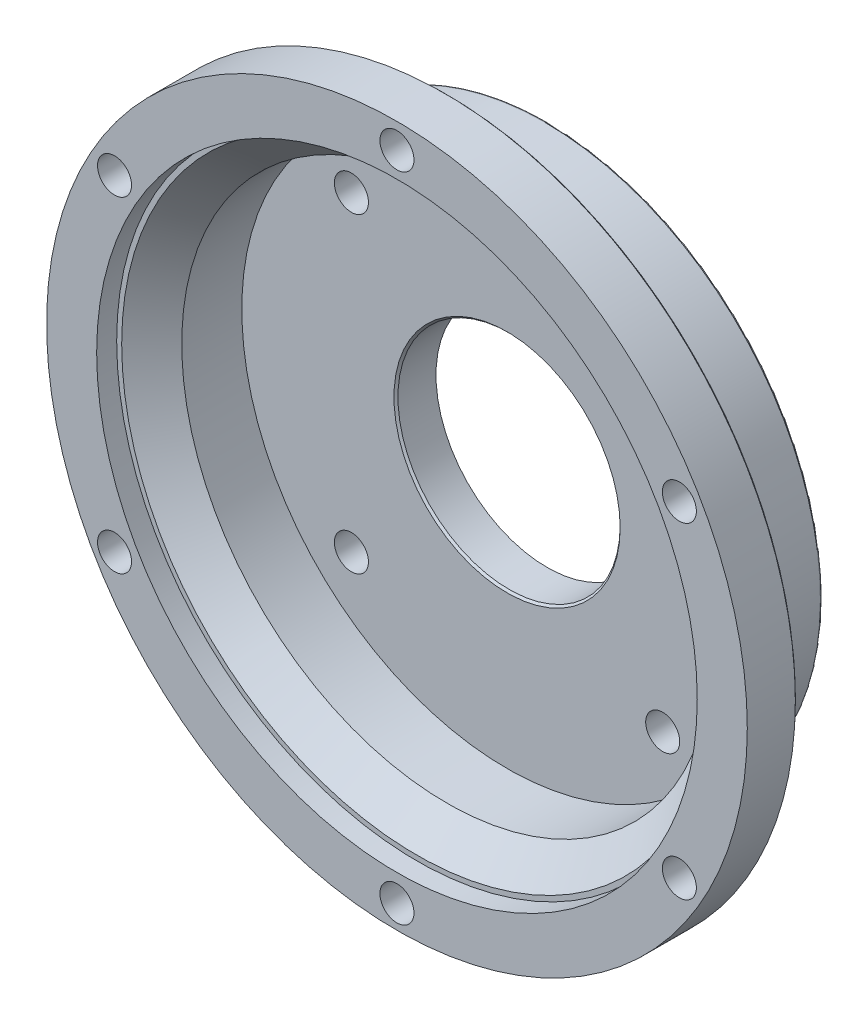
from build123d import *

# Parameters (mm, degrees)
BOSS_EXTRUDE1_DEPTH      = 5
BOSS_EXTRUDE1_DEPTH_BACK = 10
SKETCH1_R                = 35
M3_CLEARANCE_HOLE1_D     = 3.4
CIRPATTERN1_COUNT        = 6
SKETCH4_R                = 30
CUT_EXTRUDE1_DEPTH       = 2
M3_CLEARANCE_HOLE2_D     = 3.4
SKETCH8_R                = 35
SKETCH8_R_2              = 27.5
CUT_EXTRUDE4_DEPTH       = 4
FILLET1_R                = 0.2
SKETCH9_R                = 11.1
CUT_EXTRUDE5_DEPTH       = 10
SKETCH10_R               = 35
SKETCH10_R_2             = 27.5
CUT_EXTRUDE6_DEPTH       = 10
SKETCH11_R               = 26.5
CUT_EXTRUDE7_DEPTH       = 9
SKETCH12_R               = 11.1
CUT_EXTRUDE8_DEPTH       = 9
CHAMFER1_SIZE            = 0.2
CHAMFER2_SIZE            = 3


with BuildPart() as part:
    # Sketch1 → Boss-Extrude1 (new, two sides: drawn at the far end of the back side and taken through both)
    with BuildSketch(Plane.XY.offset(-BOSS_EXTRUDE1_DEPTH_BACK)):
        Circle(SKETCH1_R)
    extrude(amount=BOSS_EXTRUDE1_DEPTH + BOSS_EXTRUDE1_DEPTH_BACK)

    # M3 Clearance Hole1 (through all)
    with Locations(Plane.XY.offset(5)):
        with Locations((0, 32.5)):
            m3_clearance_hole1 = Hole(M3_CLEARANCE_HOLE1_D / 2)

    # CirPattern1: M3 Clearance Hole1 ×6 about axis
    cirpattern1_axis = Axis((0, -0.076854784, 0), (0, 0, 1))
    for i in range(1, CIRPATTERN1_COUNT):
        add(m3_clearance_hole1.rotate(cirpattern1_axis, i * 360 / CIRPATTERN1_COUNT), mode=Mode.SUBTRACT)

    # Sketch4 → Cut-Extrude1 (cut)
    with BuildSketch(Plane.XY.offset(5)):
        Circle(SKETCH4_R)
    extrude(amount=-CUT_EXTRUDE1_DEPTH, mode=Mode.SUBTRACT)

    # M3 Clearance Hole2 (through all)
    with Locations(Plane(origin=(-15.55, 15.55, 3), x_dir=(1, 0, 0), z_dir=(0, 0, 1))):
        with Locations((0, 0), (31.1, 0), (31.1, -31.1), (0, -31.1)):
            Hole(M3_CLEARANCE_HOLE2_D / 2)

    # Sketch8 → Cut-Extrude4 (cut)
    with BuildSketch(Plane(origin=(0, 0, -10), x_dir=(-1, 0, 0), z_dir=(0, 0, -1))):
        with Locations(Location((0, 0, 0), (0, 0, 180))):
            Circle(SKETCH8_R)
        Circle(SKETCH8_R_2, mode=Mode.SUBTRACT)
    extrude(amount=-CUT_EXTRUDE4_DEPTH, mode=Mode.SUBTRACT)

    # Fillet1
    fillet1_edges = [part.edges().sort_by_distance(p)[0] for p in [
        (-35, 0, -6),
        (27.5, 0, -10),
    ]]
    fillet(fillet1_edges, radius=FILLET1_R)

    # Sketch9 → Cut-Extrude5 (cut)
    with BuildSketch(Plane.XY.offset(3)):
        Circle(SKETCH9_R)
    extrude(amount=-CUT_EXTRUDE5_DEPTH, mode=Mode.SUBTRACT)

    # Sketch10 → Cut-Extrude6 (cut)
    with BuildSketch(Plane(origin=(0, 0, -10), x_dir=(-1, 0, 0), z_dir=(0, 0, -1))):
        with Locations(Location((0, 0, 0), (0, 0, 180))):
            Circle(SKETCH10_R)
        Circle(SKETCH10_R_2, mode=Mode.SUBTRACT)
    extrude(amount=-CUT_EXTRUDE6_DEPTH, mode=Mode.SUBTRACT)

    # Sketch11 → Cut-Extrude7 (cut)
    with BuildSketch(Plane.XY.offset(3)):
        Circle(SKETCH11_R)
    extrude(amount=-CUT_EXTRUDE7_DEPTH, mode=Mode.SUBTRACT)

    # Sketch12 → Cut-Extrude8 (cut)
    with BuildSketch(Plane.XY.offset(-7)):
        Circle(SKETCH12_R)
    extrude(amount=-CUT_EXTRUDE8_DEPTH, mode=Mode.SUBTRACT)

    # Chamfer1
    chamfer1_edges = [part.edges().sort_by_distance(p)[0] for p in [
        (-35, 0, 0),
        (-11.1, 0, -6),
    ]]
    chamfer(chamfer1_edges, length=CHAMFER1_SIZE)

    # Chamfer2
    chamfer2_edges = [part.edges().sort_by_distance(p)[0] for p in [
        (-26.5, 0, 3),
    ]]
    chamfer(chamfer2_edges, length=CHAMFER2_SIZE)


solid = part.part
